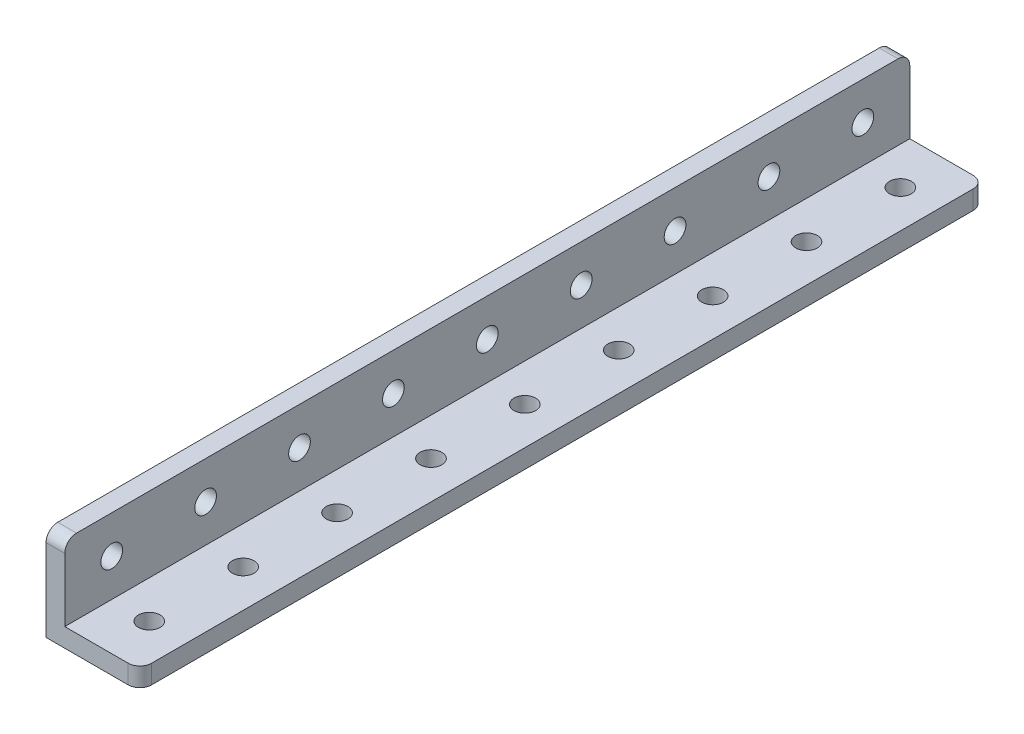
from build123d import *

# Parameters (mm, degrees)
EXTRUDE1_DEPTH      = 72
FILLET1_R           = 2
SKETCH2_R           = 1.85
CUT_EXTRUDE1_DEPTH  = 76.471849056
SKETCH3_R           = 1.85
CUT_EXTRUDE2_DEPTH  = 76.471849056
LPATTERN1_COUNT     = 5
LPATTERN1_PITCH     = 16
LPATTERN1_COL_COUNT = 5
LPATTERN1_COL_PITCH = 16


with BuildPart() as part:
    # Sketch1 → Extrude1 (new, symmetric)
    with BuildSketch(Plane.XY):
        Polygon((0, 0), (16, 0), (16, 3.2), (3.2, 3.2), (3.2, 16), (0, 16), align=None)
    extrude(amount=EXTRUDE1_DEPTH, both=True)

    # Fillet1
    fillet1_edges = [part.edges().sort_by_distance(p)[0] for p in [
        (16, 1.6, -72),
        (1.6, 16, -72),
        (1.6, 16, 72),
        (16, 1.6, 72),
    ]]
    fillet(fillet1_edges, radius=FILLET1_R)

    # Sketch2 → Cut-Extrude1 (cut, through all)
    with BuildSketch(Plane.ZY):
        with Locations(Location((0, 9.6, 0), (0, 0, 270))):
            Circle(SKETCH2_R)
    cut_extrude1 = extrude(amount=-CUT_EXTRUDE1_DEPTH, mode=Mode.SUBTRACT)

    # Sketch3 → Cut-Extrude2 (cut, through all)
    with BuildSketch(Plane.XZ):
        with Locations(Location((9.6, 0, 0), (0, 0, 270))):
            Circle(SKETCH3_R)
    cut_extrude2 = extrude(amount=-CUT_EXTRUDE2_DEPTH, mode=Mode.SUBTRACT)

    # LPattern1: Cut-Extrude1, Cut-Extrude2 ×5
    with Locations(*[(0, 0, i * LPATTERN1_PITCH) for i in range(1, LPATTERN1_COUNT)]):
        add(cut_extrude1, mode=Mode.SUBTRACT)
        add(cut_extrude2, mode=Mode.SUBTRACT)

    # LPattern1 col: Cut-Extrude1, Cut-Extrude2 ×5
    with Locations(*[(0, 0, -i * LPATTERN1_COL_PITCH) for i in range(1, LPATTERN1_COL_COUNT)]):
        add(cut_extrude1, mode=Mode.SUBTRACT)
        add(cut_extrude2, mode=Mode.SUBTRACT)


solid = part.part
